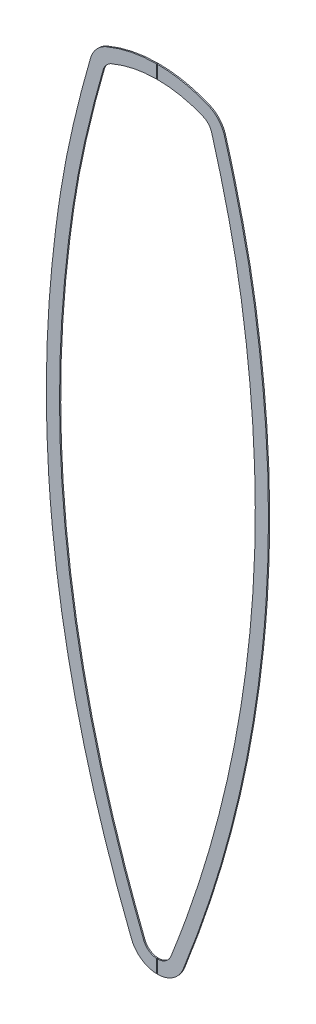
from build123d import *

# Parameters (mm, degrees)
BOSS_EXTRUDE1_DEPTH = 2.304796
SKETCH2_W           = 1.27
SKETCH2_H           = 1514.862147185
CUT_EXTRUDE1_DEPTH  = 1281.069351502


with BuildPart() as part:
    # Sketch1 → Boss-Extrude1 (new body)
    with BuildSketch(Plane.XY):
        with BuildLine():
            ThreePointArc((-49.012476183, -1227.968491723), (0.846271763, -1261.984788161), (50.705019709, -1227.968491723))
            add(Edge.make_bspline(
                [(50.705019709, -1227.968491723), (50.876541485, -1227.530644592), (52.36331753, -1223.733048391), (55.210726992, -1216.415811635), (59.247291668, -1206.0006738), (67.337886034, -1184.945972411), (79.108904217, -1153.275459712), (93.993799852, -1110.698512309), (112.759736252, -1053.563986738), (134.195553597, -981.438188519), (152.857780036, -908.462427511), (166.041693988, -849.678207818), (178.063122018, -790.572711444), (190.83744454, -716.338277578), (200.552937094, -641.705100049), (206.448473168, -581.748781993), (208.768724854, -551.664603861), (209.769442798, -536.618687959)],
                knots=[0, 0, 0, 0, 0.00195258, 0.016937234, 0.032557875, 0.048178516, 0.11066108, 0.173143643, 0.235626207, 0.360591334, 0.485556462, 0.548039025, 0.610521589, 0.735486716, 0.860451843, 0.922934407, 0.985416971, 0.985416971, 0.985416971, 0.985416971], degree=3))
            add(Edge.make_bspline(
                [(209.769442798, -536.618687959), (211.022785934, -517.774670682), (213.015154655, -480.045210541), (214.979203287, -404.551394934), (213.887978686, -328.957247078), (209.759366173, -253.547846613), (205.182331515, -197.02091496), (200.609734071, -153.721383907), (197.651535298, -129.273131339), (196.943639376, -123.594731745)],
                knots=[0.54023228, 0.54023228, 0.54023228, 0.54023228, 0.602347455, 0.664462629, 0.788692977, 0.850808151, 0.912923325, 0.975038499, 0.993842785, 0.993842785, 0.993842785, 0.993842785], degree=3))
            add(Edge.make_bspline(
                [(196.943639376, -123.594731745), (195.313181288, -110.515983509), (191.080146378, -78.718212884), (183.283897421, -28.376345026), (174.50909818, 17.839855462), (166.530923366, 54.667671174), (160.119972002, 82.252196411), (153.387950608, 109.867348445), (146.433800478, 137.436973344), (139.218665538, 164.814576611), (133.773055793, 184.09972107), (130.453314003, 195.45309398), (129.775305463, 197.755615438), (129.440861548, 198.887948289)],
                knots=[0.178448911, 0.178448911, 0.178448911, 0.178448911, 0.221759799, 0.283874973, 0.345990147, 0.377047734, 0.408105321, 0.439162908, 0.470220495, 0.501278082, 0.532335669, 0.536350082, 0.54023228, 0.54023228, 0.54023228, 0.54023228], degree=3))
            ThreePointArc((129.440861548, 198.887948289), (118.002457463, 219.414249941), (98.877648319, 233.067374959))
            ThreePointArc((98.877648319, 233.067374959), (0.846271763, 252.877447424), (-97.185104793, 233.067374959))
            ThreePointArc((-97.185104793, 233.067374959), (-116.309913937, 219.414249941), (-127.748318022, 198.887948289))
            add(Edge.make_bspline(
                [(-127.748318022, 198.887948289), (-128.082761937, 197.755615438), (-128.760770477, 195.45309398), (-132.080512266, 184.09972107), (-137.526122011, 164.814576611), (-144.741256951, 137.436973344), (-151.695407081, 109.867348445), (-158.427428476, 82.252196411), (-164.83837984, 54.667671174), (-172.816554654, 17.839855462), (-181.591353895, -28.376345026), (-189.387602851, -78.718212884), (-193.620637762, -110.515983509), (-195.251095849, -123.594731745)],
                knots=[0.178448911, 0.178448911, 0.178448911, 0.178448911, 0.182331109, 0.186345522, 0.217403109, 0.248460696, 0.279518283, 0.31057587, 0.341633458, 0.372691045, 0.434806219, 0.496921393, 0.54023228, 0.54023228, 0.54023228, 0.54023228], degree=3))
            add(Edge.make_bspline(
                [(-195.251095849, -123.594731745), (-195.958991771, -129.273131339), (-198.917190544, -153.721383907), (-203.489787989, -197.02091496), (-208.066822647, -253.547846613), (-212.19543516, -328.957247078), (-213.28665976, -404.551394934), (-211.322611129, -480.045210541), (-209.330242407, -517.774670682), (-208.076899272, -536.618687959)],
                knots=[0.54023228, 0.54023228, 0.54023228, 0.54023228, 0.559036567, 0.621151741, 0.683266915, 0.745382089, 0.869612437, 0.931727611, 0.993842785, 0.993842785, 0.993842785, 0.993842785], degree=3))
            add(Edge.make_bspline(
                [(-208.076899272, -536.618687959), (-207.076181328, -551.664603861), (-204.755929642, -581.748781993), (-198.860393568, -641.705100049), (-189.144901014, -716.338277578), (-176.370578492, -790.572711444), (-164.349150462, -849.678207818), (-151.165236509, -908.462427511), (-132.503010071, -981.438188519), (-111.067192726, -1053.563986738), (-92.301256326, -1110.698512309), (-77.416360691, -1153.275459712), (-65.645342508, -1184.945972411), (-57.554748142, -1206.0006738), (-53.518183465, -1216.415811635), (-50.670774003, -1223.733048391), (-49.183997958, -1227.530644592), (-49.012476183, -1227.968491723)],
                knots=[0, 0, 0, 0, 0.062482564, 0.124965127, 0.249930255, 0.374895382, 0.437377946, 0.499860509, 0.624825637, 0.749790764, 0.812273328, 0.874755891, 0.937238455, 0.952859096, 0.968479737, 0.983464391, 0.985416971, 0.985416971, 0.985416971, 0.985416971], degree=3))
        make_face()
        with BuildLine():
            ThreePointArc((-25.362399167, -1218.703835381), (0.846271763, -1236.584788161), (27.054942693, -1218.703835381))
            add(Edge.make_bspline(
                [(27.054942693, -1218.703835381), (28.400217106, -1215.269725977), (31.071527006, -1208.410261533), (36.438744963, -1194.570757623), (42.985240683, -1177.47065912), (50.654706246, -1156.86494819), (60.615251709, -1129.323026418), (72.583624331, -1094.676579393), (90.695710655, -1038.897350426), (111.388508474, -968.495707326), (129.401415384, -897.311669678), (142.129404955, -839.985670396), (153.737986392, -782.359777703), (166.079144877, -710.010906133), (175.478922652, -637.295429512), (181.195138388, -578.89126959), (183.45070388, -549.588282457), (184.425439017, -534.933021219)],
                knots=[0, 0, 0, 0, 0.01539714, 0.030794281, 0.061588562, 0.092382843, 0.123177124, 0.184765685, 0.246354247, 0.369531371, 0.492708495, 0.554297056, 0.615885618, 0.739062742, 0.862239865, 0.923828427, 0.985416989, 0.985416989, 0.985416989, 0.985416989], degree=3))
            add(Edge.make_bspline(
                [(184.425439017, -534.933021219), (186.685591164, -500.951627859), (189.524526931, -432.872907401), (188.778905417, -330.633361226), (182.988482095, -228.610193148), (175.9618181, -160.612367611), (171.7387425, -126.736892387)],
                knots=[0.54023228, 0.54023228, 0.54023228, 0.54023228, 0.653634907, 0.767037533, 0.880440159, 0.993842785, 0.993842785, 0.993842785, 0.993842785], degree=3))
            add(Edge.make_bspline(
                [(171.7387425, -126.736892387), (170.055397257, -113.233908903), (166.451057758, -86.235371304), (160.322918197, -45.970354742), (153.28834279, -6.080764228), (145.25715691, 33.578532738), (137.730400326, 66.60521796), (131.32525971, 93.168196548), (126.380227886, 113.122171485), (121.322734312, 132.999041364), (116.143154484, 152.69872086), (111.658558519, 168.954283037), (107.94481502, 181.937664809), (106.040479885, 188.445175846), (105.081174829, 191.693112438)],
                knots=[0.178448911, 0.178448911, 0.178448911, 0.178448911, 0.223671832, 0.268894753, 0.314117675, 0.359340596, 0.404563517, 0.427174977, 0.449786438, 0.472397899, 0.495009359, 0.51762082, 0.52892655, 0.54023228, 0.54023228, 0.54023228, 0.54023228], degree=3))
            ThreePointArc((105.081174829, 191.693112438), (99.0682696, 202.483315828), (89.0147985, 209.660448774))
            ThreePointArc((89.0147985, 209.660448774), (0.846271763, 227.477447424), (-87.322254974, 209.660448774))
            ThreePointArc((-87.322254974, 209.660448774), (-97.375726074, 202.483315828), (-103.388631302, 191.693112438))
            add(Edge.make_bspline(
                [(-103.388631302, 191.693112438), (-104.347936358, 188.445175846), (-106.252271493, 181.937664809), (-109.966014993, 168.954283037), (-114.450610958, 152.69872086), (-119.630190785, 132.999041364), (-124.68768436, 113.122171485), (-129.632716184, 93.168196548), (-136.037856799, 66.60521796), (-143.564613383, 33.578532738), (-151.595799264, -6.080764228), (-158.630374671, -45.970354742), (-164.758514232, -86.235371304), (-168.362853731, -113.233908903), (-170.046198974, -126.736892387)],
                knots=[0.178448911, 0.178448911, 0.178448911, 0.178448911, 0.189754641, 0.201060372, 0.223671832, 0.246283293, 0.268894753, 0.291506214, 0.314117675, 0.359340596, 0.404563517, 0.449786438, 0.495009359, 0.54023228, 0.54023228, 0.54023228, 0.54023228], degree=3))
            add(Edge.make_bspline(
                [(-170.046198974, -126.736892387), (-174.269274574, -160.612367611), (-181.295938569, -228.610193148), (-187.086361891, -330.633361226), (-187.831983404, -432.872907401), (-184.993047638, -500.951627859), (-182.732895491, -534.93302122)],
                knots=[0.54023228, 0.54023228, 0.54023228, 0.54023228, 0.653634907, 0.767037533, 0.880440159, 0.993842785, 0.993842785, 0.993842785, 0.993842785], degree=3))
            add(Edge.make_bspline(
                [(-182.732895491, -534.93302122), (-181.758160354, -549.588282457), (-179.502594861, -578.89126959), (-173.786379125, -637.295429512), (-164.386601351, -710.010906133), (-152.045442866, -782.359777703), (-140.436861429, -839.985670396), (-127.708871858, -897.311669678), (-109.695964947, -968.495707326), (-89.003167129, -1038.897350426), (-70.891080805, -1094.676579393), (-58.922708183, -1129.323026418), (-48.96216272, -1156.86494819), (-41.292697157, -1177.47065912), (-34.746201437, -1194.570757623), (-29.378983479, -1208.410261533), (-26.70767358, -1215.269725977), (-25.362399167, -1218.703835381)],
                knots=[-1.8e-08, -1.8e-08, -1.8e-08, -1.8e-08, 0.061588543, 0.123177105, 0.246354229, 0.369531353, 0.431119914, 0.492708476, 0.6158856, 0.739062723, 0.800651285, 0.862239847, 0.893034128, 0.923828409, 0.95462269, 0.97001983, 0.985416971, 0.985416971, 0.985416971, 0.985416971], degree=3))
        make_face(mode=Mode.SUBTRACT)
    extrude(amount=BOSS_EXTRUDE1_DEPTH)

    # Sketch2 → Cut-Extrude1 (cut, through all)
    with BuildSketch(Plane.XY.offset(2.304796)):
        with Locations((0, -504.553714569)):
            Rectangle(SKETCH2_W, SKETCH2_H)
    extrude(amount=-CUT_EXTRUDE1_DEPTH, mode=Mode.SUBTRACT)


with BuildPart() as cut_extrude1_piece_1:
    # of the separate pieces the step leaves, piece 1, a body of its own (cut_extrude1_pieces)
    add(part.part.solids().sort_by_distance((98.877648319, 233.067374959, 0))[0])


with BuildPart() as cut_extrude1_piece_2:
    # of the separate pieces the step leaves, piece 2, a body of its own (cut_extrude1_pieces)
    add(part.part.solids().sort_by_distance((-97.185104793, 233.067374959, 0))[0])


solid = Compound([cut_extrude1_piece_1.part, cut_extrude1_piece_2.part])
